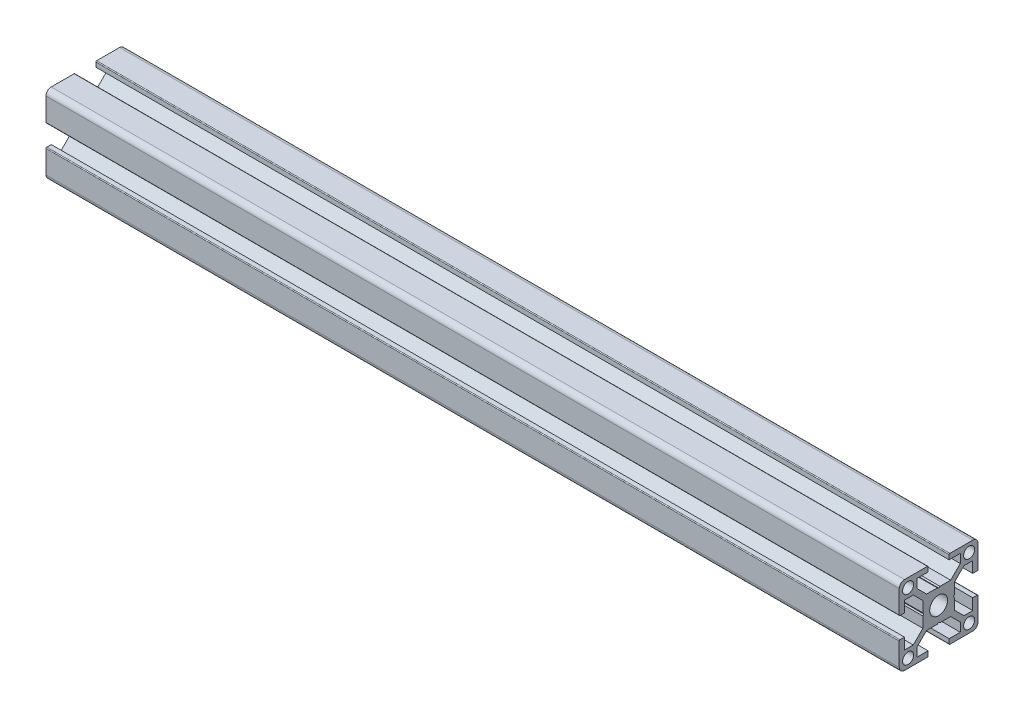
from build123d import *

# Parameters (mm, degrees)
SKETCH_1_R              = 2.1
SKETCH_1_R_2            = 3.4
F_30XS6_30X30S6_1_DEPTH = 325


with BuildPart() as part:
    # 草图1 → 30xs6 30X30S6(1) (new body)
    with BuildSketch(Plane.YZ):
        with BuildLine():
            Line((-14.7, 4), (-13, 4))
            Line((-13, 4), (-13, 8.25))
            Line((-13, 8.25), (-9.664213562, 8.25))
            Line((-9.664213562, 8.25), (-6, 4.585786438))
            Line((-6, 4.585786438), (-6, 0.519615242))
            Line((-6, 0.519615242), (-5.7, 0))
            Line((-5.7, 0), (-6, -0.519615242))
            Line((-6, -0.519615242), (-6, -4.585786438))
            Line((-6, -4.585786438), (-9.664213562, -8.25))
            Line((-9.664213562, -8.25), (-13, -8.25))
            Line((-13, -8.25), (-13, -4))
            Line((-13, -4), (-14.7, -4))
            ThreePointArc((-14.7, -4), (-14.912132034, -4.087867966), (-15, -4.3))
            Line((-15, -4.3), (-15, -13))
            ThreePointArc((-15, -13), (-14.414213562, -14.414213562), (-13, -15))
            Line((-13, -15), (-4.3, -15))
            ThreePointArc((-4.3, -15), (-4.087867966, -14.912132034), (-4, -14.7))
            Line((-4, -14.7), (-4, -13))
            Line((-4, -13), (-8.25, -13))
            Line((-8.25, -13), (-8.25, -9.664213562))
            Line((-8.25, -9.664213562), (-4.585786438, -6))
            Line((-4.585786438, -6), (-0.519615242, -6))
            Line((-0.519615242, -6), (0, -5.7))
            Line((0, -5.7), (0.519615242, -6))
            Line((0.519615242, -6), (4.585786438, -6))
            Line((4.585786438, -6), (8.25, -9.664213562))
            Line((8.25, -9.664213562), (8.25, -13))
            Line((8.25, -13), (4, -13))
            Line((4, -13), (4, -14.7))
            ThreePointArc((4, -14.7), (4.087867966, -14.912132034), (4.3, -15))
            Line((4.3, -15), (13, -15))
            ThreePointArc((13, -15), (14.414213562, -14.414213562), (15, -13))
            Line((15, -13), (15, -4.3))
            ThreePointArc((15, -4.3), (14.912132034, -4.087867966), (14.7, -4))
            Line((14.7, -4), (13, -4))
            Line((13, -4), (13, -8.25))
            Line((13, -8.25), (9.664213562, -8.25))
            Line((9.664213562, -8.25), (6, -4.585786438))
            Line((6, -4.585786438), (6, -0.519615242))
            Line((6, -0.519615242), (5.7, 0))
            Line((5.7, 0), (6, 0.519615242))
            Line((6, 0.519615242), (6, 4.585786438))
            Line((6, 4.585786438), (9.664213562, 8.25))
            Line((9.664213562, 8.25), (13, 8.25))
            Line((13, 8.25), (13, 4))
            Line((13, 4), (14.7, 4))
            ThreePointArc((14.7, 4), (14.912132034, 4.087867966), (15, 4.3))
            Line((15, 4.3), (15, 13))
            ThreePointArc((15, 13), (14.414213562, 14.414213562), (13, 15))
            Line((13, 15), (4.3, 15))
            ThreePointArc((4.3, 15), (4.087867966, 14.912132034), (4, 14.7))
            Line((4, 14.7), (4, 13))
            Line((4, 13), (8.25, 13))
            Line((8.25, 13), (8.25, 9.664213562))
            Line((8.25, 9.664213562), (4.585786438, 6))
            Line((4.585786438, 6), (0.519615242, 6))
            Line((0.519615242, 6), (0, 5.7))
            Line((0, 5.7), (-0.519615242, 6))
            Line((-0.519615242, 6), (-4.585786438, 6))
            Line((-4.585786438, 6), (-8.25, 9.664213562))
            Line((-8.25, 9.664213562), (-8.25, 13))
            Line((-8.25, 13), (-4, 13))
            Line((-4, 13), (-4, 14.7))
            ThreePointArc((-4, 14.7), (-4.087867966, 14.912132034), (-4.3, 15))
            Line((-4.3, 15), (-13, 15))
            ThreePointArc((-13, 15), (-14.414213562, 14.414213562), (-15, 13))
            Line((-15, 13), (-15, 4.3))
            ThreePointArc((-15, 4.3), (-14.912132034, 4.087867966), (-14.7, 4))
        make_face()
        with Locations((11.625, 11.625)):
            Circle(SKETCH_1_R, mode=Mode.SUBTRACT)
        with Locations((11.625, -11.625)):
            Circle(SKETCH_1_R, mode=Mode.SUBTRACT)
        Circle(SKETCH_1_R_2, mode=Mode.SUBTRACT)
        with Locations((-11.625, -11.625)):
            Circle(SKETCH_1_R, mode=Mode.SUBTRACT)
        with Locations((-11.625, 11.625)):
            Circle(SKETCH_1_R, mode=Mode.SUBTRACT)
    extrude(amount=F_30XS6_30X30S6_1_DEPTH)


solid = part.part
